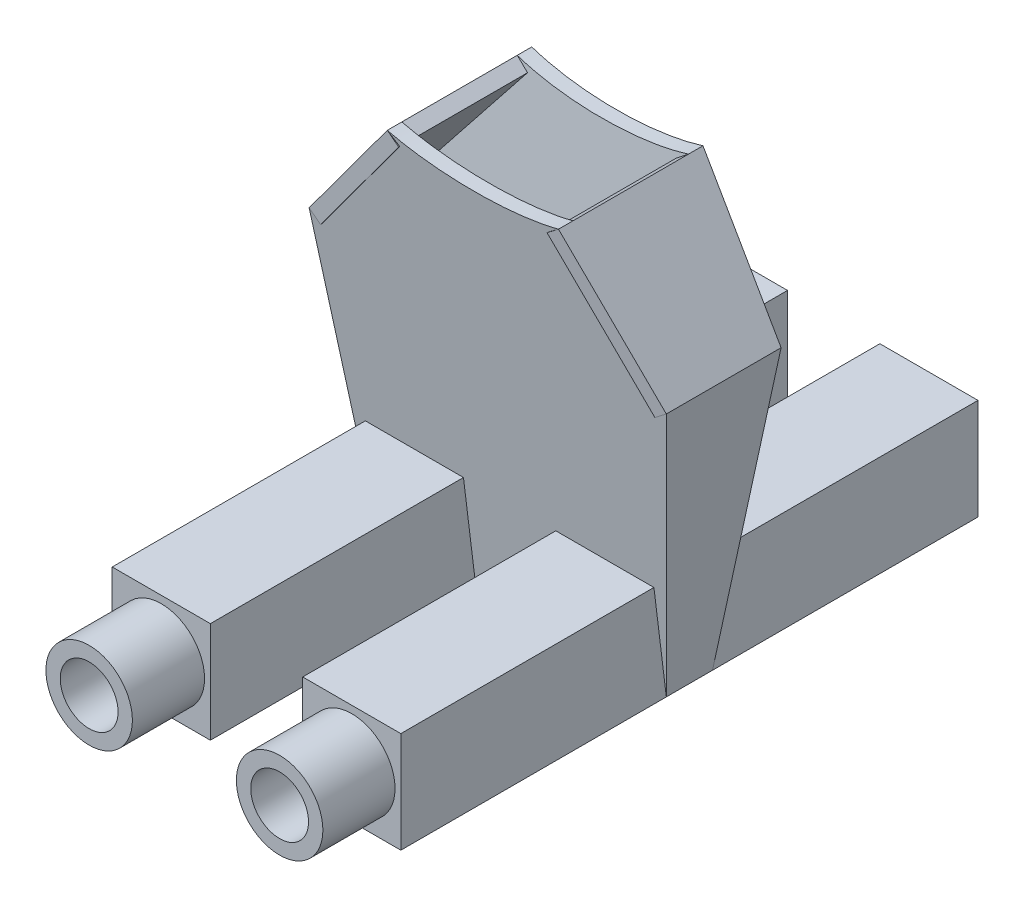
from build123d import *

# Parameters (mm, degrees)
SKETCH1_W                = 10
SKETCH1_H                = 1.6
BOSS_EXTRUDE1_DEPTH      = 15
BOSS_EXTRUDE1_TAPER      = -7
SHELL1_T                 = -0.5
SKETCH6_W                = 3.4
SKETCH6_H                = 20
BOSS_EXTRUDE2_DEPTH      = 3.5
BOSS_EXTRUDE2_2_DEPTH    = 3.5
CUT_EXTRUDE11_DEPTH      = 10
CUT_EXTRUDE11_DEPTH_BACK = 10
SKETCH11_RX              = 4.5
SKETCH11_RY              = 1.5
CUT_EXTRUDE12_DEPTH      = 10
BOSS_EXTRUDE3_DEPTH      = 0.5
SKETCH20_R               = 1.499118307
BOSS_EXTRUDE4_DEPTH      = 2.5
SKETCH22_R               = 1.001403974
CUT_EXTRUDE13_DEPTH      = 13
SKETCH25_W               = 2
SKETCH25_H               = 1.4
CUT_EXTRUDE14_DEPTH      = 1.5
SKETCH28_R               = 1.498355692
BOSS_EXTRUDE5_DEPTH      = 2.5
SKETCH29_R               = 1.002174376
CUT_EXTRUDE15_DEPTH      = 13
SKETCH30_W               = 3.2
SKETCH30_H               = 1.6
BOSS_EXTRUDE6_DEPTH      = 9
BOSS_EXTRUDE6_TAPER      = -6


with BuildPart() as part:
    # Sketch1 → Boss-Extrude1 (new body)
    with BuildSketch(Plane(origin=(0, 0, 0), x_dir=(1, 0, 0), z_dir=(0, 1, 0))):
        Rectangle(SKETCH1_W, SKETCH1_H)
    extrude(amount=BOSS_EXTRUDE1_DEPTH, taper=BOSS_EXTRUDE1_TAPER)

    # Shell1
    shell1_openings = [part.faces().sort_by_distance(p)[0] for p in [
        (0, 15, 0),
    ]]
    offset(amount=SHELL1_T, openings=shell1_openings, kind=Kind.INTERSECTION)

    # Sketch11 → Cut-Extrude11 (cut, two sides: drawn at the far end of the back side and taken through both)
    with BuildSketch(Plane.XY.offset(-CUT_EXTRUDE11_DEPTH_BACK)):
        with Locations((0, 15)):
            Ellipse(SKETCH11_RX, SKETCH11_RY)
    extrude(amount=CUT_EXTRUDE11_DEPTH + CUT_EXTRUDE11_DEPTH_BACK, mode=Mode.SUBTRACT)

    # Sketch18 → Cut-Extrude12 (cut, symmetric)
    with BuildSketch(Plane.XY):
        Polygon((-2.966549011, 13.872092056), (-6.188554642, 9.680000756), (-6.937287507, 15.777940591), (-2.966549011, 15.777940591), align=None)
    cut_extrude12 = extrude(amount=CUT_EXTRUDE12_DEPTH, both=True, mode=Mode.SUBTRACT)

    # Sketch19 → Boss-Extrude3 (add)
    with BuildSketch(Plane(origin=(-8.567447802, 6.584867333, 0), x_dir=(0, 0, 1), z_dir=(-0.7928688844776028, 0.6093922644957365, 0))):
        Polygon((1.988554642, 3.903714074), (2.503278732, 9.190958134), (-2.503278732, 9.190958134), (-1.988554642, 3.903714074), align=None)
    boss_extrude3 = extrude(amount=-BOSS_EXTRUDE3_DEPTH)

    # Mirror2: Cut-Extrude12 across plane
    add(cut_extrude12.mirror(Plane(origin=(0, 0, 0), x_dir=(0, 0, 1), z_dir=(1, 0, 0))), mode=Mode.SUBTRACT)

    # Mirror3: Boss-Extrude3 across plane
    add(boss_extrude3.mirror(Plane(origin=(0, 0, 0), x_dir=(0, 0, 1), z_dir=(1, 0, 0))))


with BuildPart() as body_2:
    # Sketch6 → Boss-Extrude2 (new body)
    with BuildSketch(Plane.XZ):
        with Locations((-3.3, 0)):
            Rectangle(SKETCH6_W, SKETCH6_H)
    extrude(amount=-BOSS_EXTRUDE2_DEPTH)


with BuildPart() as body_3:
    # Sketch6 → Boss-Extrude2 2 (new body)
    with BuildSketch(Plane.XZ):
        with Locations((3.3, 0)):
            Rectangle(SKETCH6_W, SKETCH6_H)
    extrude(amount=-BOSS_EXTRUDE2_2_DEPTH)

    # Sketch20 → Boss-Extrude4 (add)
    with BuildSketch(Plane.XY.offset(10)):
        with Locations((3.3, 1.75)):
            Circle(SKETCH20_R)
    extrude(amount=BOSS_EXTRUDE4_DEPTH)


with BuildPart() as cut_extrude13_tool:
    # Sketch22 → Cut-Extrude13 (new body)
    with BuildSketch(Plane.XY.offset(12.5)):
        with Locations((3.3, 1.75)):
            Circle(SKETCH22_R)
    extrude(amount=-CUT_EXTRUDE13_DEPTH)


with BuildPart() as part_1:
    add(part.part)

    # Cut-Extrude13: cut by cut_extrude13_tool
    add(cut_extrude13_tool.part, mode=Mode.SUBTRACT)


with BuildPart() as body_3_1:
    add(body_3.part)

    # Cut-Extrude13: cut by cut_extrude13_tool
    add(cut_extrude13_tool.part, mode=Mode.SUBTRACT)


with BuildPart() as cut_extrude14_tool:
    # Sketch25 → Cut-Extrude14 (new body)
    with BuildSketch(Plane(origin=(0, 3.5, 0), x_dir=(1, 0, 0), z_dir=(0, 1, 0))):
        with Locations((-3.371950412, 0.026080252)):
            Rectangle(SKETCH25_W, SKETCH25_H)
    cut_extrude14 = extrude(amount=-CUT_EXTRUDE14_DEPTH)


with BuildPart() as part_2:
    add(part_1.part)

    # Cut-Extrude14: cut by cut_extrude14_tool
    add(cut_extrude14_tool.part, mode=Mode.SUBTRACT)


with BuildPart() as body_2_1:
    add(body_2.part)

    # Cut-Extrude14: cut by cut_extrude14_tool
    add(cut_extrude14_tool.part, mode=Mode.SUBTRACT)

    # Sketch28 → Boss-Extrude5 (add)
    with BuildSketch(Plane.XY.offset(10)):
        with Locations((-3.3, 1.75)):
            Circle(SKETCH28_R)
    extrude(amount=BOSS_EXTRUDE5_DEPTH)


with BuildPart() as mirror6_tool:
    # Mirror6: Cut-Extrude14 across plane
    add(cut_extrude14.mirror(Plane(origin=(0, 0, 0), x_dir=(0, 0, 1), z_dir=(1, 0, 0))))


with BuildPart() as part_3:
    add(part_2.part)

    # Mirror6: cut by mirror6_tool
    add(mirror6_tool.part, mode=Mode.SUBTRACT)


with BuildPart() as body_3_2:
    add(body_3_1.part)

    # Mirror6: cut by mirror6_tool
    add(mirror6_tool.part, mode=Mode.SUBTRACT)


with BuildPart() as cut_extrude15_tool:
    # Sketch29 → Cut-Extrude15 (new body)
    with BuildSketch(Plane.XY.offset(12.5)):
        with Locations((-3.3, 1.75)):
            Circle(SKETCH29_R)
    extrude(amount=-CUT_EXTRUDE15_DEPTH)


with BuildPart() as part_4:
    add(part_3.part)

    # Cut-Extrude15: cut by cut_extrude15_tool
    add(cut_extrude15_tool.part, mode=Mode.SUBTRACT)



with BuildPart() as body_2_2:
    add(body_2_1.part)

    # Cut-Extrude15: cut by cut_extrude15_tool
    add(cut_extrude15_tool.part, mode=Mode.SUBTRACT)


with BuildPart() as part_5:
    add(part_4.part)

    add(body_2_2.part)  # Boss-Extrude6 merges body 2

    add(body_3_2.part)  # Boss-Extrude6 merges body 3
    # Sketch30 → Boss-Extrude6 (add)
    with BuildSketch(Plane.XZ):
        Rectangle(SKETCH30_W, SKETCH30_H)
    extrude(amount=-BOSS_EXTRUDE6_DEPTH, taper=BOSS_EXTRUDE6_TAPER)


solid = part_5.part
